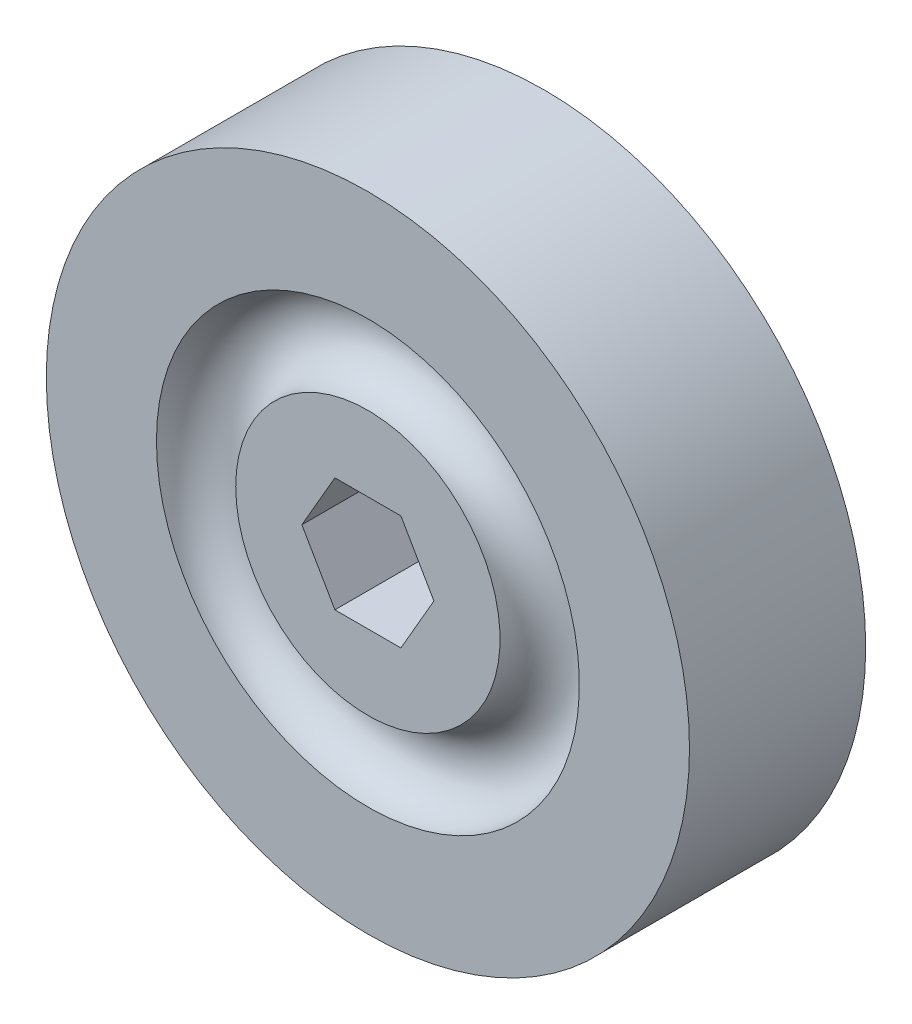
from build123d import *

# Parameters (mm, degrees)
SKETCH1_R           = 36.5
BOSS_EXTRUDE1_DEPTH = 20


with BuildPart() as part:
    # Sketch1 → Boss-Extrude1 (new body)
    with BuildSketch(Plane.XY):
        Circle(SKETCH1_R)
        Polygon((7.493, 0), (3.7465, 6.489128351), (-3.7465, 6.489128351), (-7.493, 0), (-3.7465, -6.489128351), (3.7465, -6.489128351), align=None, mode=Mode.SUBTRACT)
    extrude(amount=BOSS_EXTRUDE1_DEPTH)

    # Cut-Sweep2: sweep along a path in Sketch3
    with BuildLine(Plane(origin=(0, 0, 0), x_dir=(-1, 0, 0), z_dir=(0, 0, -1))) as cut_sweep2_path:
        CenterArc((0, 0), 19.5, 0, 360)
    # Sketch2 → Cut-Sweep2 (sweep, cut)
    with BuildSketch(Plane(origin=(0, 0, 0), x_dir=(1, 0, 0), z_dir=(0, 1, 0))):
        with BuildLine():
            Line((-24, 0), (-15, 0))
            ThreePointArc((-15, 0), (-19.5, -4.5), (-24, 0))
        make_face()
    cut_sweep2 = sweep(path=cut_sweep2_path.line, mode=Mode.SUBTRACT)

    # Mirror1: Cut-Sweep2 across plane
    add(cut_sweep2.mirror(Plane.XY.offset(10)), mode=Mode.SUBTRACT)


solid = part.part
